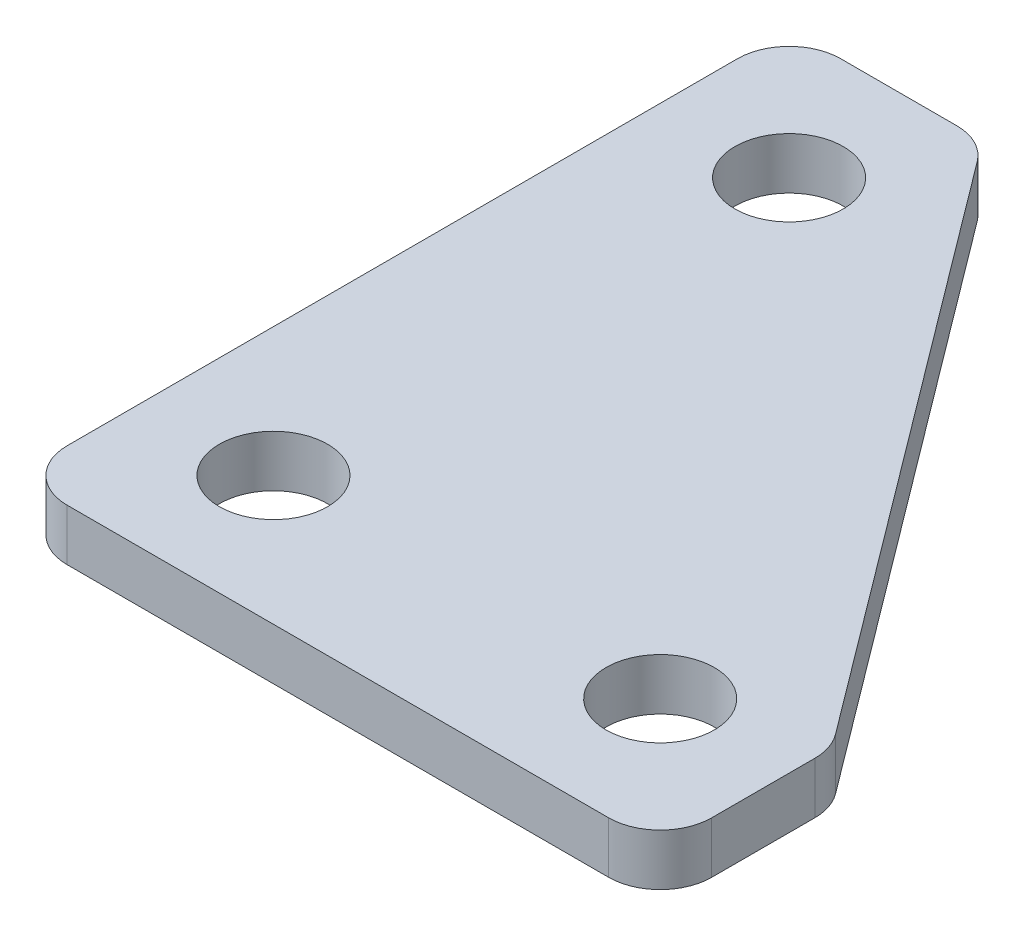
from build123d import *

# Parameters (mm, degrees)
SKETCH_1_R      = 2.1
EXTRUDE_1_DEPTH = 2
FILLET_1_R      = 2


with BuildPart() as part:
    # ｽｹｯﾁ1 → ﾎﾞｽ - 押し出し1 (new body)
    with BuildSketch(Plane(origin=(0, 0, 0), x_dir=(1, 0, 0), z_dir=(0, 1, 0))):
        Polygon((-5, 25), (-5, -5), (20, -5), (20, 1.666666667), (2.5, 25), align=None)
        with Locations(Location((0, 20, 0), (0, 0, 270))):
            Circle(SKETCH_1_R, mode=Mode.SUBTRACT)
        with Locations(Location((0, 0, 0), (0, 0, 270))):
            Circle(SKETCH_1_R, mode=Mode.SUBTRACT)
        with Locations(Location((15, 0, 0), (0, 0, 270))):
            Circle(SKETCH_1_R, mode=Mode.SUBTRACT)
    extrude(amount=EXTRUDE_1_DEPTH)

    # ﾌｨﾚｯﾄ1
    fillet_1_edges = [part.edges().sort_by_distance(p)[0] for p in [
        (-5, 1, -25),
        (2.5, 1, -25),
        (20, 1, -1.666666667),
        (20, 1, 5),
        (-5, 1, 5),
    ]]
    fillet(fillet_1_edges, radius=FILLET_1_R)


solid = part.part
